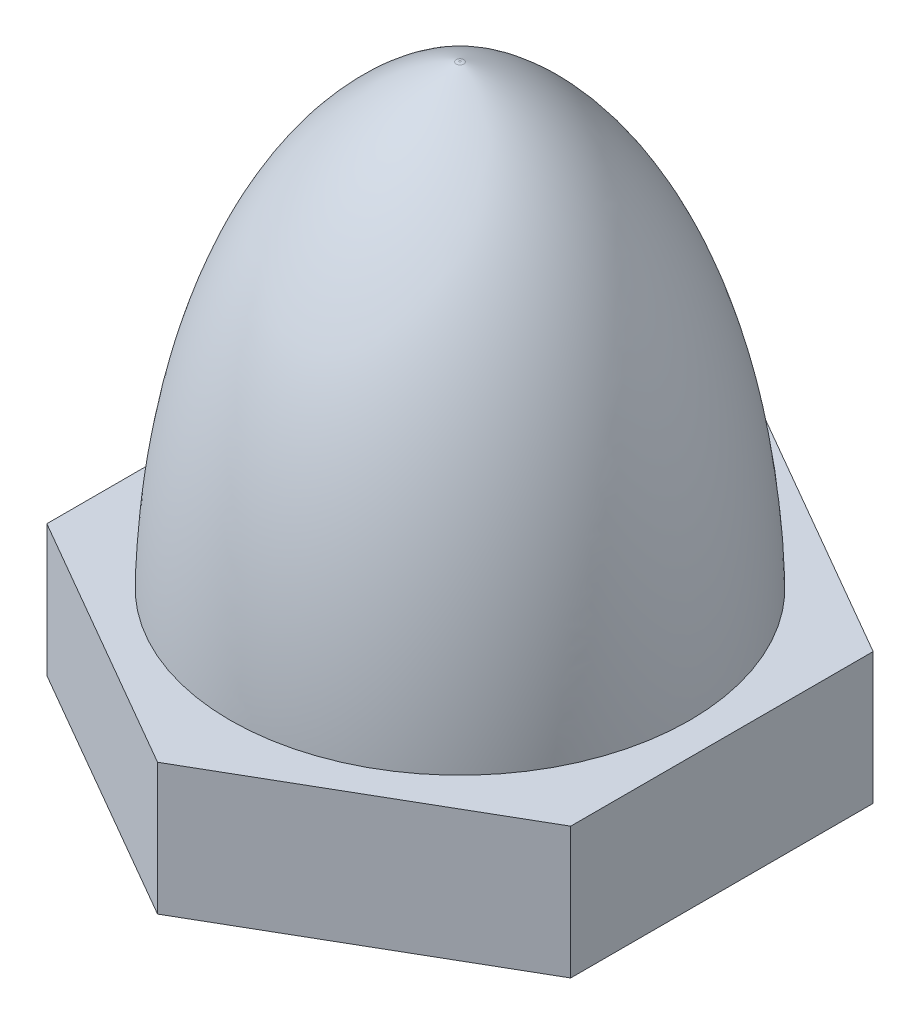
from build123d import *

# Parameters (mm, degrees)
SALIENTE_EXTRUIR1_DEPTH = 3
CROQUIS2_R              = 5.5
SALIENTE_EXTRUIR2_DEPTH = 10.4
REDONDEO3_R             = 0.2
CROQUIS4_R              = 2.5
CORTAR_EXTRUIR1_DEPTH   = 10


with BuildPart() as part:
    # Croquis1 → Saliente-Extruir1 (new body)
    with BuildSketch(Plane(origin=(0, 0, 0), x_dir=(1, 0, 0), z_dir=(0, 1, 0))):
        Polygon((0, -6.9), (5.975575286, -3.45), (5.975575286, 3.45), (0, 6.9), (-5.975575286, 3.45), (-5.975575286, -3.45), align=None)
    extrude(amount=SALIENTE_EXTRUIR1_DEPTH)

    # Croquis2 → Saliente-Extruir2 (add)
    with BuildSketch(Plane(origin=(0, 3, 0), x_dir=(1, 0, 0), z_dir=(0, 1, 0))):
        with Locations(Location((0, 0, 0), (0, 0, 270))):
            Circle(CROQUIS2_R)
    extrude(amount=SALIENTE_EXTRUIR2_DEPTH)

    # Croquis3 → Cortar-Revolución17 (revolve, cut)
    with BuildSketch(Plane(origin=(0, 0, 0), x_dir=(0.8660254037844386, 0, 0.5000000000000001), z_dir=(-0.5000000000000001, 0, 0.8660254037844386))):
        with BuildLine():
            Line((-0.05505313, 13.4), (-9.065705725, 13.4))
            Line((-9.065705725, 13.4), (-9.065705725, 3))
            Line((-9.065705725, 3), (-5.242775997, 3))
            add(Edge.make_bspline(
                [(-0.05505313, 13.4), (-3.55300642, 12.195542183), (-5.129402013, 7.591757737), (-5.242775997, 3)],
                knots=[0.003430867, 0.003430867, 0.003430867, 0.003430867, 0.878426724, 0.878426724, 0.878426724, 0.878426724], degree=3))
        make_face()
    revolve(axis=Axis((0, 16.4, 0), (0, -1, 0)), mode=Mode.SUBTRACT)

    # Redondeo3
    redondeo3_edges = [part.edges().sort_by_distance(p)[0] for p in [
        (0.04767741, 13.4, 0.027526565),
    ]]
    fillet(redondeo3_edges, radius=REDONDEO3_R)

    # Croquis4 → Cortar-Extruir1 (cut)
    with BuildSketch(Plane.XZ):
        with Locations(Location((0, 0, 0), (0, 0, 270))):
            Circle(CROQUIS4_R)
    extrude(amount=-CORTAR_EXTRUIR1_DEPTH, mode=Mode.SUBTRACT)


solid = part.part
